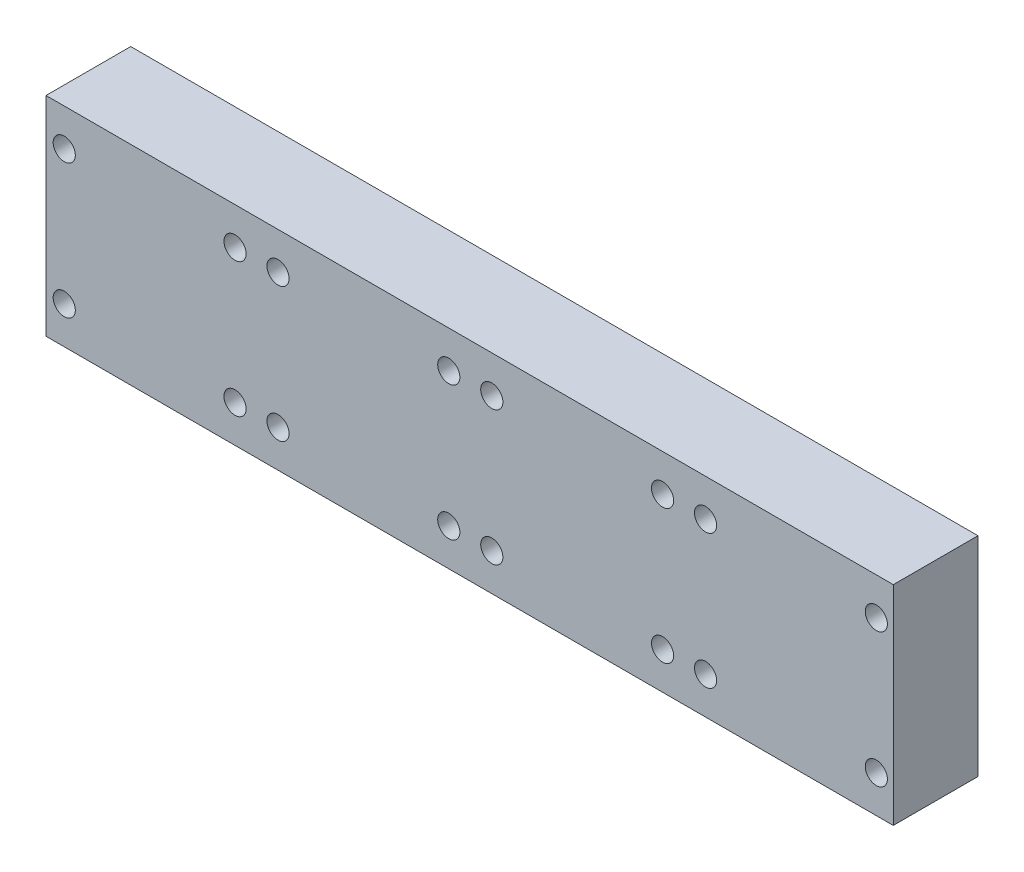
from build123d import *

# Parameters (mm, degrees)
ESQUISSE1_W                = 130
ESQUISSE1_H                = 32
ESQUISSE1_R                = 1.5
BOSS_EXTRU_1_DEPTH         = 13
D_GAGEMENT_M31_D           = 3.4
D_GAGEMENT_M31_DEPTH       = 13
R_P_TITION_LIN_AIRE1_COUNT = 4
R_P_TITION_LIN_AIRE1_PITCH = 32.8


with BuildPart() as part:
    # Esquisse1 → Boss.-Extru.1 (new body)
    with BuildSketch(Plane.XY):
        with Locations((65, 16)):
            Rectangle(ESQUISSE1_W, ESQUISSE1_H)
        with Locations(Location((2.8, 26.3, 0), (0, 0, 180))):
            Circle(ESQUISSE1_R, mode=Mode.SUBTRACT)
        with Locations(Location((29, 26.3, 0), (0, 0, 180))):
            Circle(ESQUISSE1_R, mode=Mode.SUBTRACT)
        with Locations(Location((2.8, 5.7, 0), (0, 0, 180))):
            Circle(ESQUISSE1_R, mode=Mode.SUBTRACT)
        with Locations(Location((29, 5.7, 0), (0, 0, 180))):
            Circle(ESQUISSE1_R, mode=Mode.SUBTRACT)
    extrude(amount=BOSS_EXTRU_1_DEPTH)

    # Dégagement M31
    with Locations(Plane.XY.offset(13)):
        with Locations((2.8, 26.3), (29, 26.3), (2.8, 5.7), (29, 5.7)):
            d_gagement_m31 = Hole(D_GAGEMENT_M31_D / 2, depth=D_GAGEMENT_M31_DEPTH)

    # Répétition linéaire1: Dégagement M31 ×4
    with Locations(*[(i * R_P_TITION_LIN_AIRE1_PITCH, 0, 0) for i in range(1, R_P_TITION_LIN_AIRE1_COUNT)]):
        add(d_gagement_m31, mode=Mode.SUBTRACT)


solid = part.part
